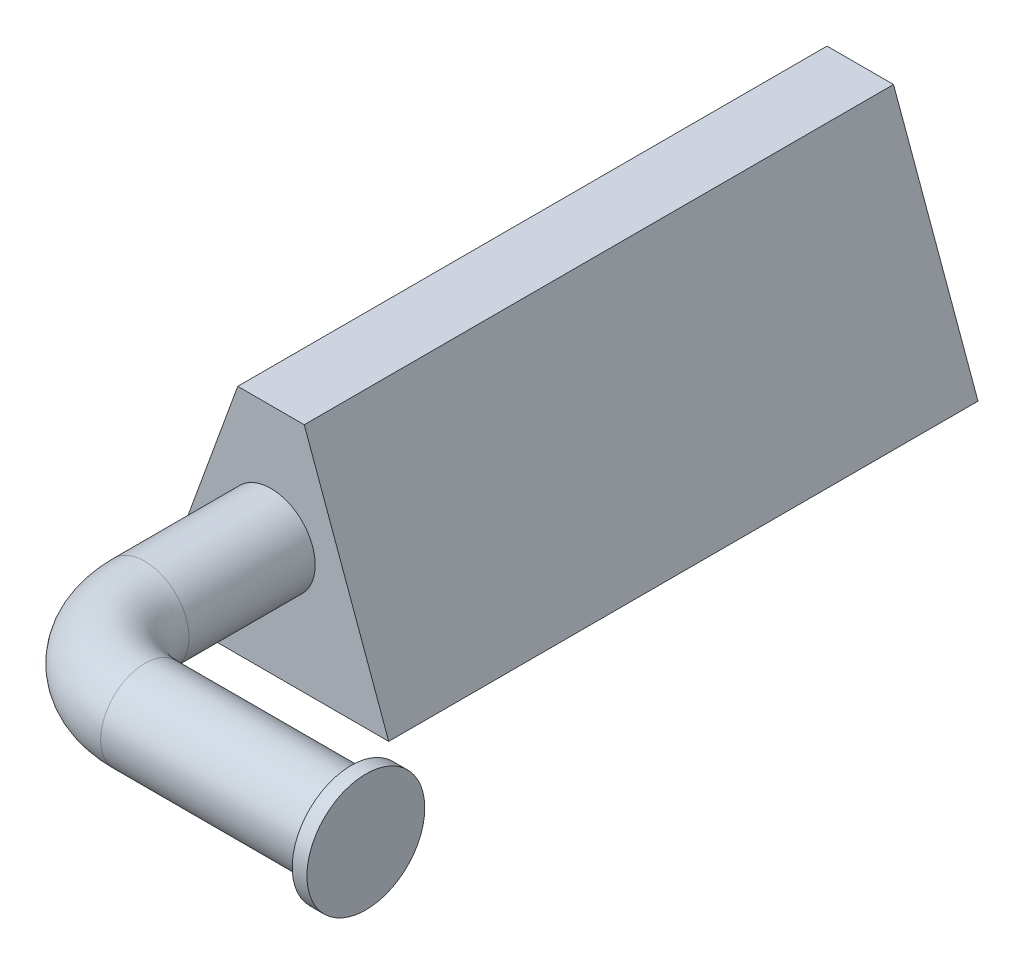
from build123d import *

# Parameters (mm, degrees)
BOSS_EXTRUDE1_DEPTH = 40
SKETCH4_R           = 3
SKETCH5_R           = 4
BOSS_EXTRUDE2_DEPTH = 1


with BuildPart() as part:
    # Sketch1 → Boss-Extrude1 (new body)
    with BuildSketch(Plane.XY):
        Polygon((15.979053375, 0), (10.246522185, 15.75), (5.73253119, 15.75), (0, 0), align=None)
    extrude(amount=BOSS_EXTRUDE1_DEPTH)

    # Sweep1: sweep along a path in Sketch3
    with BuildLine(Plane(origin=(0, 7.875, 0), x_dir=(-1, 0, 0), z_dir=(0, -1, 0))) as sweep1_path:
        Line((-7.989526687, -40), (-7.989526687, -48.56216486))
        ThreePointArc((-7.989526687, -48.56216486), (-9.746886, -52.804805547), (-13.989526687, -54.56216486))
        Line((-13.989526687, -54.56216486), (-27.989526687, -54.56216486))
    # Sketch4 → Sweep1 (sweep)
    with BuildSketch(Plane(origin=(27.989526687, 0, 0), x_dir=(0, 0, -1), z_dir=(1, 0, 0))):
        with Locations((-54.56216486, 7.875)):
            Circle(SKETCH4_R)
    sweep(path=sweep1_path.line)

    # Sketch5 → Boss-Extrude2 (add)
    with BuildSketch(Plane(origin=(27.989526687, 0, 0), x_dir=(0, 0, -1), z_dir=(1, 0, 0))):
        with Locations((-54.56216486, 7.875)):
            Circle(SKETCH5_R)
    extrude(amount=BOSS_EXTRUDE2_DEPTH)


solid = part.part
